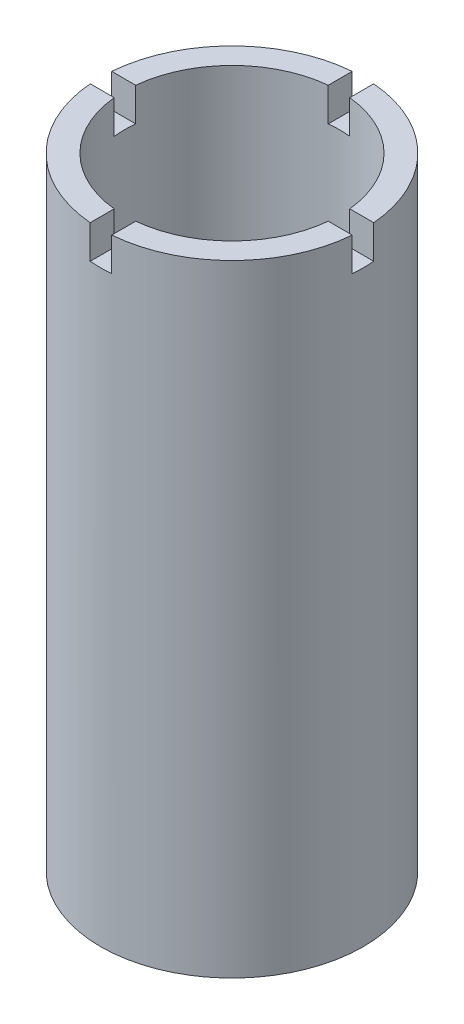
from build123d import *

# Parameters (mm, degrees)
SKETCH1_R           = 27.5
SKETCH1_R_2         = 22.5
BOSS_EXTRUDE1_DEPTH = 130
CUT_EXTRUDE1_START  = -7
CUT_EXTRUDE1_DEPTH  = 7


with BuildPart() as part:
    # Sketch1 → Boss-Extrude1 (new body)
    with BuildSketch(Plane(origin=(0, 0, 0), x_dir=(1, 0, 0), z_dir=(0, 1, 0))):
        with Locations(Location((0, 0, 0), (0, 0, 270))):
            Circle(SKETCH1_R)
        with Locations(Location((0, 0, 0), (0, 0, 270))):
            Circle(SKETCH1_R_2, mode=Mode.SUBTRACT)
    extrude(amount=BOSS_EXTRUDE1_DEPTH)

    # Sketch2 → Cut-Extrude1 (cut)
    with BuildSketch(Plane(origin=(0, 130, 0), x_dir=(1, 0, 0), z_dir=(0, 1, 0)).offset(CUT_EXTRUDE1_START)):
        with BuildLine():
            Line((-27.407799985, 2.25), (-22.387217335, 2.25))
            ThreePointArc((-22.387217335, 2.25), (-22.5, 0), (-22.387217335, -2.25))
            Line((-22.387217335, -2.25), (-27.407799985, -2.25))
            ThreePointArc((-27.407799985, -2.25), (-27.5, 0), (-27.407799985, 2.25))
        make_face()
        with BuildLine():
            Line((27.407799985, -2.25), (22.387217335, -2.25))
            ThreePointArc((22.387217335, -2.25), (22.5, 0), (22.387217335, 2.25))
            Line((22.387217335, 2.25), (27.407799985, 2.25))
            ThreePointArc((27.407799985, 2.25), (27.5, 0), (27.407799985, -2.25))
        make_face()
        with BuildLine():
            Line((-2.25, 27.407799985), (-2.25, 22.387217335))
            ThreePointArc((-2.25, 22.387217335), (0, 22.5), (2.25, 22.387217335))
            Line((2.25, 22.387217335), (2.25, 27.407799985))
            ThreePointArc((2.25, 27.407799985), (0, 27.5), (-2.25, 27.407799985))
        make_face()
        with BuildLine():
            Line((-2.25, -27.407799985), (-2.25, -22.387217335))
            ThreePointArc((-2.25, -22.387217335), (0, -22.5), (2.25, -22.387217335))
            Line((2.25, -22.387217335), (2.25, -27.407799985))
            ThreePointArc((2.25, -27.407799985), (0, -27.5), (-2.25, -27.407799985))
        make_face()
    extrude(amount=CUT_EXTRUDE1_DEPTH, mode=Mode.SUBTRACT)


solid = part.part
